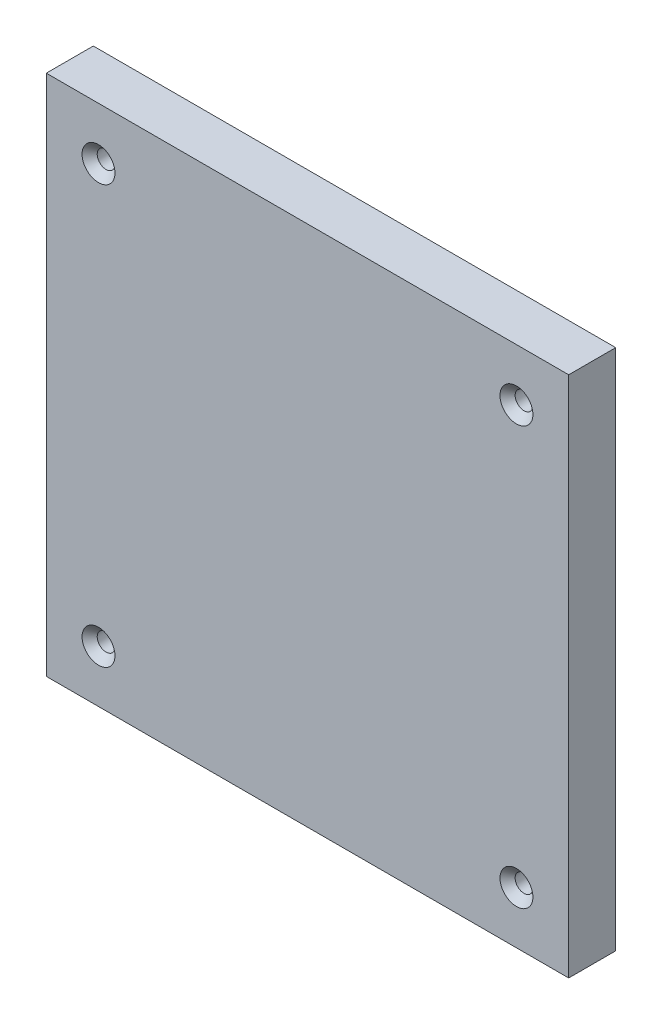
from build123d import *

# Parameters (mm, degrees)
SKETCH_1_W                  = 100
SKETCH_1_H                  = 100
EXTRUDE_1_DEPTH             = 9
HOLE_WIZARD_M3_1_AT_2_COUNT = 2
HOLE_WIZARD_M3_1_AT_2_PITCH = 80
HOLE_WIZARD_M3_1_AT_3_COUNT = 2
HOLE_WIZARD_M3_1_AT_3_PITCH = 113.13708499
HOLE_WIZARD_M3_1_AT_4_COUNT = 2
HOLE_WIZARD_M3_1_AT_4_PITCH = 80


with BuildPart() as part:
    # 草圖1 → 填料-伸長1 (new body)
    with BuildSketch(Plane.XY):
        Rectangle(SKETCH_1_W, SKETCH_1_H)
    extrude(amount=EXTRUDE_1_DEPTH)

    # 草圖4 → M3 平頭機械螺釘的錐孔1 (revolve, cut)
    with BuildSketch(Plane(origin=(-40, 40, 9), x_dir=(0, -1, 0), z_dir=(1, 0, 0))):
        Polygon((0, 0), (0, 9), (1.725, 9), (1.7, 8.975), (1.7, 1.45), (3.15, 0), align=None)
    hole_wizard_m3_1 = revolve(axis=Axis((-40, 40, 15.35), (0, 0, -1)), mode=Mode.SUBTRACT)

    # M3 平頭機械螺釘的錐孔1 at 2: M3 平頭機械螺釘的錐孔1 ×2
    with Locations(*[(i * HOLE_WIZARD_M3_1_AT_2_PITCH, 0, 0) for i in range(1, HOLE_WIZARD_M3_1_AT_2_COUNT)]):
        add(hole_wizard_m3_1, mode=Mode.SUBTRACT)

    # M3 平頭機械螺釘的錐孔1 at 3: M3 平頭機械螺釘的錐孔1 ×2
    with Locations(*[Vector(0.7071067811865476, -0.7071067811865476, 0) * (i * HOLE_WIZARD_M3_1_AT_3_PITCH) for i in range(1, HOLE_WIZARD_M3_1_AT_3_COUNT)]):
        add(hole_wizard_m3_1, mode=Mode.SUBTRACT)

    # M3 平頭機械螺釘的錐孔1 at 4: M3 平頭機械螺釘的錐孔1 ×2
    with Locations(*[(0, -i * HOLE_WIZARD_M3_1_AT_4_PITCH, 0) for i in range(1, HOLE_WIZARD_M3_1_AT_4_COUNT)]):
        add(hole_wizard_m3_1, mode=Mode.SUBTRACT)


solid = part.part
